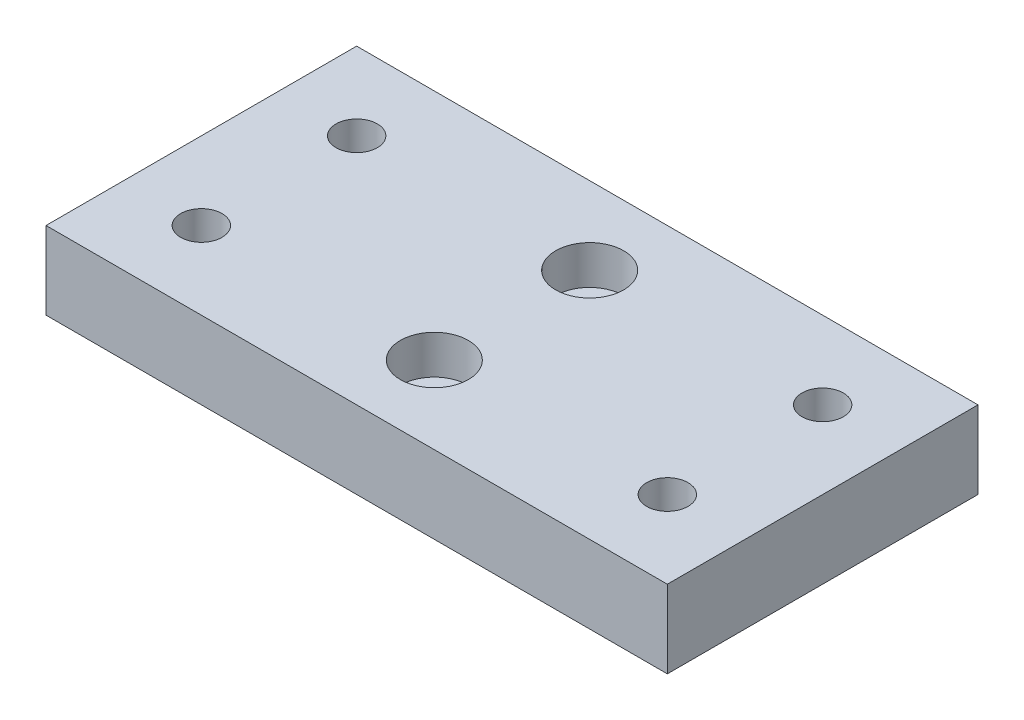
from build123d import *

# Parameters (mm, degrees)
SKETCH1_W                                        = 101.6
SKETCH1_H                                        = 50.8
BOSS_EXTRUDE1_DEPTH                              = 6.35
F_1_4_CLEARANCE_HOLE1_D                          = 6.7564
CBORE_FOR_1_4_SOCKET_HEAD_CAP_SCREW1_D           = 6.7564
CBORE_FOR_1_4_SOCKET_HEAD_CAP_SCREW1_CBORE_D     = 11.1125
CBORE_FOR_1_4_SOCKET_HEAD_CAP_SCREW1_CBORE_DEPTH = 6.35


with BuildPart() as part:
    # Sketch1 → Boss-Extrude1 (new, symmetric)
    with BuildSketch(Plane(origin=(0, 0, 0), x_dir=(1, 0, 0), z_dir=(0, 1, 0))):
        Rectangle(SKETCH1_W, SKETCH1_H)
    extrude(amount=BOSS_EXTRUDE1_DEPTH, both=True)

    # 1/4 Clearance Hole1 (through all)
    with Locations(Plane(origin=(0, 6.35, 0), x_dir=(1, 0, 0), z_dir=(0, 1, 0))):
        with Locations((-38.1, 12.7), (-38.1, -12.7), (38.1, 12.7), (38.1, -12.7)):
            Hole(F_1_4_CLEARANCE_HOLE1_D / 2)

    # CBORE for 1/4 Socket Head Cap Screw1 (through all)
    with Locations(Plane(origin=(0, 6.35, 0), x_dir=(1, 0, 0), z_dir=(0, 1, 0))):
        with Locations((0, 12.7), (0, -12.7)):
            CounterBoreHole(CBORE_FOR_1_4_SOCKET_HEAD_CAP_SCREW1_D / 2, CBORE_FOR_1_4_SOCKET_HEAD_CAP_SCREW1_CBORE_D / 2, CBORE_FOR_1_4_SOCKET_HEAD_CAP_SCREW1_CBORE_DEPTH)


solid = part.part
